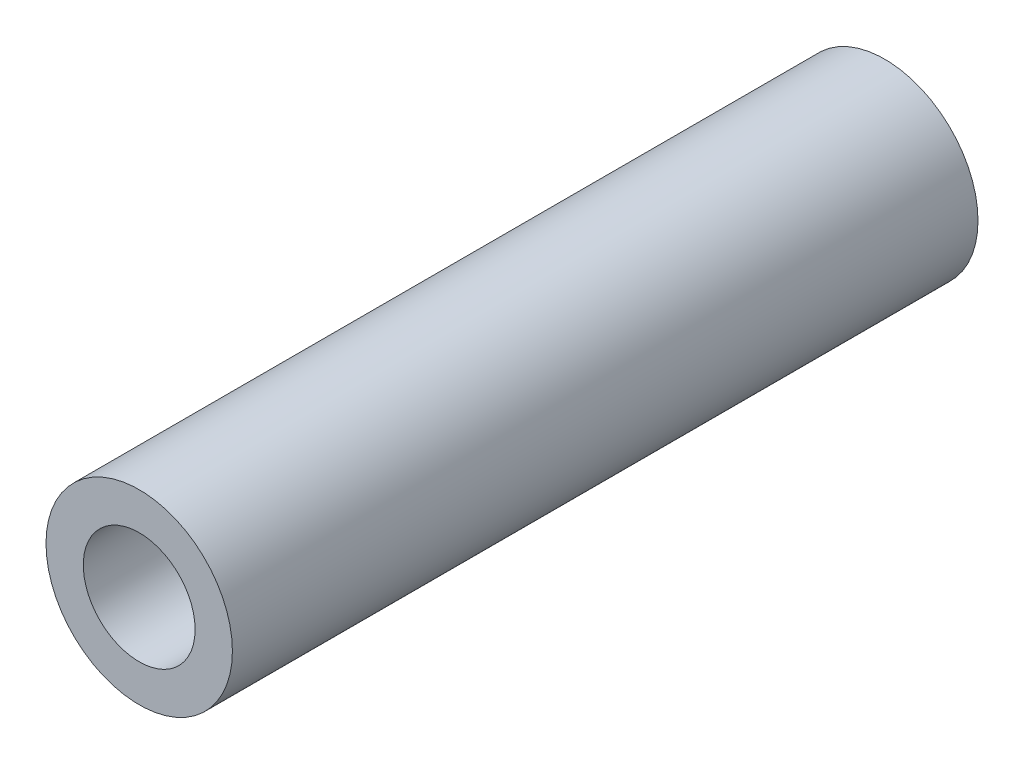
from build123d import *

# Parameters (mm, degrees)
SKETCH_1_R      = 2.5
SKETCH_1_R_2    = 1.5
EXTRUDE_1_DEPTH = 10


with BuildPart() as part:
    # 草图1 → 凸台-拉伸1 (new, symmetric)
    with BuildSketch(Plane.XY):
        Circle(SKETCH_1_R)
        Circle(SKETCH_1_R_2, mode=Mode.SUBTRACT)
    extrude(amount=EXTRUDE_1_DEPTH, both=True)


solid = part.part
